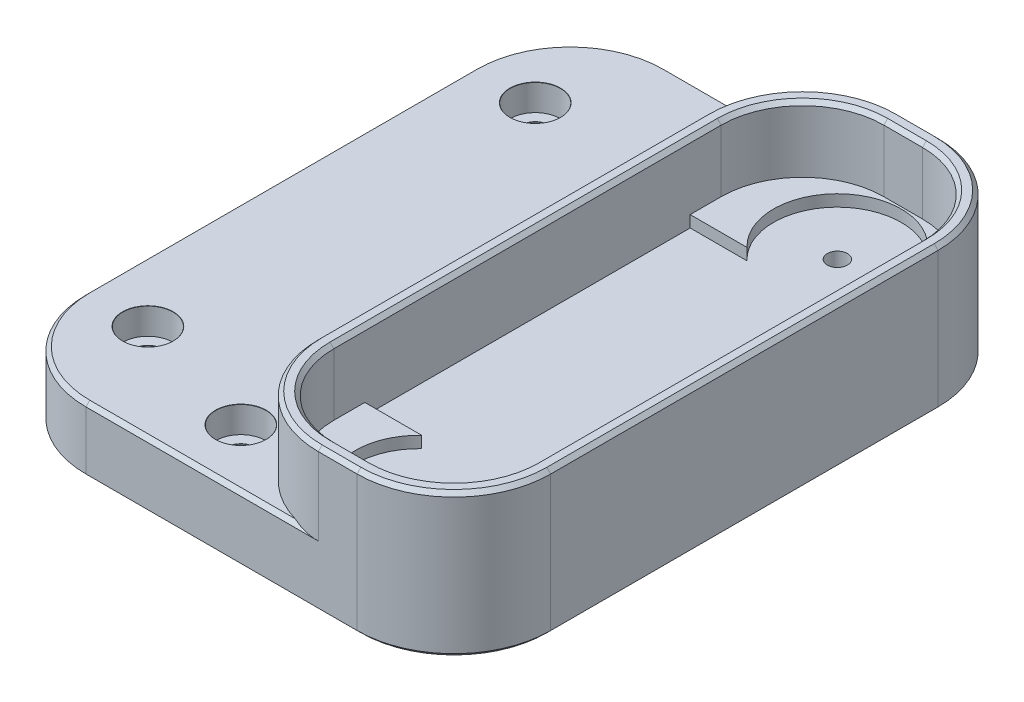
from build123d import *

# Parameters (mm, degrees)
BOSS_EXTRUDE1_DEPTH                          = 75
SKETCH2_R                                    = 1.3
CUT_EXTRUDE1_DEPTH                           = 34
CBORE_FOR_M3_HEX_SOCKET_HEAD_CAP_SCR_2_COUNT = 2
CBORE_FOR_M3_HEX_SOCKET_HEAD_CAP_SCR_2_PITCH = 60
CBORE_FOR_M3_HEX_SOCKET_HEAD_CAP_SCR_3_COUNT = 2
CBORE_FOR_M3_HEX_SOCKET_HEAD_CAP_SCR_3_PITCH = 57.567351858
CBORE_FOR_M3_HEX_SOCKET_HEAD_CAP_SCR_4_COUNT = 2
CBORE_FOR_M3_HEX_SOCKET_HEAD_CAP_SCR_4_PITCH = 17.720045147
FILLET2_R                                    = 12.5
BOSS_EXTRUDE2_START                          = 10
BOSS_EXTRUDE2_DEPTH                          = 10
CHAMFER3_SIZE                                = 0.5
BOSS_EXTRUDE3_START                          = 1.5
BOSS_EXTRUDE3_DEPTH                          = 1.5


with BuildPart() as part:
    # Sketch1 → Boss-Extrude1 (new body)
    with BuildSketch(Plane.XY):
        Polygon((0, 0), (60, 0), (60, 8.5), (30, 8.5), (0, 8.5), align=None)
    extrude(amount=BOSS_EXTRUDE1_DEPTH)

    # Sketch2 → Cut-Extrude1 (cut)
    with BuildSketch(Plane(origin=(0, 8.5, 0), x_dir=(1, 0, 0), z_dir=(0, 1, 0))):
        with Locations(Location((45, -64.5, 0), (0, 0, 180))):
            Circle(SKETCH2_R)
        with Locations(Location((45, -10.5, 0), (0, 0, 180))):
            Circle(SKETCH2_R)
    extrude(amount=-CUT_EXTRUDE1_DEPTH, mode=Mode.SUBTRACT)

    # Sketch4 → CBORE for M3 Hex Socket Head Cap Screw1 (revolve, cut)
    with BuildSketch(Plane(origin=(25, 8.5, 67.5), x_dir=(0, 0, 1), z_dir=(1, 0, 0))):
        Polygon((0, 0), (0, 8.5), (1.825, 8.5), (1.8, 8.475), (1.8, 3.425), (1.825, 3.4), (3.25, 3.4), (3.25, 0.025), (3.275, 0), align=None)
    cbore_for_m3_hex_socket_head_cap_screw1 = revolve(axis=Axis((25, 14.85, 67.5), (0, -1, 0)), mode=Mode.SUBTRACT)

    # CBORE for M3 Hex Socket Head Cap Scr 2: CBORE for M3 Hex Socket Head Cap Screw1 ×2
    with Locations(*[(0, 0, -i * CBORE_FOR_M3_HEX_SOCKET_HEAD_CAP_SCR_2_PITCH) for i in range(1, CBORE_FOR_M3_HEX_SOCKET_HEAD_CAP_SCR_2_COUNT)]):
        add(cbore_for_m3_hex_socket_head_cap_screw1, mode=Mode.SUBTRACT)

    # CBORE for M3 Hex Socket Head Cap Scr 3: CBORE for M3 Hex Socket Head Cap Screw1 ×2
    with Locations(*[Vector(-0.2953062708492605, 0, -0.9554026409829016) * (i * CBORE_FOR_M3_HEX_SOCKET_HEAD_CAP_SCR_3_PITCH) for i in range(1, CBORE_FOR_M3_HEX_SOCKET_HEAD_CAP_SCR_3_COUNT)]):
        add(cbore_for_m3_hex_socket_head_cap_screw1, mode=Mode.SUBTRACT)

    # CBORE for M3 Hex Socket Head Cap Scr 4: CBORE for M3 Hex Socket Head Cap Screw1 ×2
    with Locations(*[Vector(-0.9593655015712707, 0, -0.28216632399155017) * (i * CBORE_FOR_M3_HEX_SOCKET_HEAD_CAP_SCR_4_PITCH) for i in range(1, CBORE_FOR_M3_HEX_SOCKET_HEAD_CAP_SCR_4_COUNT)]):
        add(cbore_for_m3_hex_socket_head_cap_screw1, mode=Mode.SUBTRACT)

    # Fillet2
    fillet2_edges = [part.edges().sort_by_distance(p)[0] for p in [
        (60, 4.25, 75),
        (0, 4.25, 75),
        (60, 4.25, 0),
        (0, 4.25, 0),
    ]]
    fillet(fillet2_edges, radius=FILLET2_R)

    # Sketch5 → Boss-Extrude2 (add)
    with BuildSketch(Plane(origin=(0, 8.5, 0), x_dir=(1, 0, 0), z_dir=(0, 1, 0)).offset(BOSS_EXTRUDE2_START)):
        with BuildLine():
            Line((47.5, 0), (42.5, 0))
            ThreePointArc((42.5, 0), (33.661165235, -3.661165235), (30, -12.5))
            Line((30, -12.5), (30, -62.5))
            ThreePointArc((30, -62.5), (33.661165235, -71.338834765), (42.5, -75))
            Line((42.5, -75), (47.5, -75))
            ThreePointArc((47.5, -75), (56.338834765, -71.338834765), (60, -62.5))
            Line((60, -62.5), (60, -12.5))
            ThreePointArc((60, -12.5), (56.338834765, -3.661165235), (47.5, 0))
        make_face()
        with BuildLine():
            Line((47.5, -2), (42.5, -2))
            ThreePointArc((42.5, -2), (35.075378798, -5.075378798), (32, -12.5))
            Line((32, -12.5), (32, -62.5))
            ThreePointArc((32, -62.5), (35.075378798, -69.924621202), (42.5, -73))
            Line((42.5, -73), (47.5, -73))
            ThreePointArc((47.5, -73), (54.924621202, -69.924621202), (58, -62.5))
            Line((58, -62.5), (58, -12.5))
            ThreePointArc((58, -12.5), (54.924621202, -5.075378798), (47.5, -2))
        make_face(mode=Mode.SUBTRACT)
    extrude(amount=-BOSS_EXTRUDE2_DEPTH)

    # Chamfer3
    chamfer3_edges = [part.edges().sort_by_distance(p)[0] for p in [
        (27.5, 8.5, 0),
        (27.5, 8.5, 75),
        (33.661165235, 18.5, 3.661165235),
        (30, 18.5, 37.5),
        (33.661165235, 18.5, 71.338834765),
        (45, 18.5, 75),
        (56.338834765, 18.5, 71.338834765),
        (60, 18.5, 37.5),
        (56.338834765, 18.5, 3.661165235),
        (45, 18.5, 0),
        (35.075378798, 18.5, 69.924621202),
        (45, 18.5, 73),
        (54.924621202, 18.5, 69.924621202),
        (58, 18.5, 37.5),
        (54.924621202, 18.5, 5.075378798),
        (45, 18.5, 2),
        (35.075378798, 18.5, 5.075378798),
        (32, 18.5, 37.5),
        (0, 0, 37.5),
        (0, 8.5, 37.5),
        (30, 0, 0),
        (60, 0, 37.5),
        (30, 0, 75),
        (56.338834765, 0, 71.338834765),
        (56.338834765, 0, 3.661165235),
        (3.661165235, 0, 71.338834765),
        (3.661165235, 0, 3.661165235),
        (3.661165235, 8.5, 71.338834765),
        (3.661165235, 8.5, 3.661165235),
    ]]
    chamfer(chamfer3_edges, length=CHAMFER3_SIZE)

    # Sketch6 → Boss-Extrude3 (add)
    with BuildSketch(Plane(origin=(0, 8.5, 0), x_dir=(1, 0, 0), z_dir=(0, 1, 0)).offset(BOSS_EXTRUDE3_START)):
        with BuildLine():
            Line((50.662375826, -16.5), (58, -16.5))
            Line((58, -16.5), (58, -12.5))
            ThreePointArc((58, -12.5), (54.924621202, -5.075378798), (47.5, -2))
            Line((47.5, -2), (42.5, -2))
            ThreePointArc((42.5, -2), (35.075378798, -5.075378798), (32, -12.5))
            Line((32, -12.5), (32, -16.5))
            Line((32, -16.5), (39.337624174, -16.5))
            ThreePointArc((39.337624174, -16.5), (41.732898882, -2.924476897), (53.25, -10.5))
            ThreePointArc((53.25, -10.5), (52.575523103, -13.767101118), (50.662375826, -16.5))
        make_face()
        with BuildLine():
            Line((58, -62.5), (58, -58.5))
            Line((58, -58.5), (50.662375826, -58.5))
            ThreePointArc((50.662375826, -58.5), (52.575523103, -61.232898882), (53.25, -64.5))
            ThreePointArc((53.25, -64.5), (41.732898882, -72.075523103), (39.337624174, -58.5))
            Line((39.337624174, -58.5), (32, -58.5))
            Line((32, -58.5), (32, -62.5))
            ThreePointArc((32, -62.5), (35.075378798, -69.924621202), (42.5, -73))
            Line((42.5, -73), (47.5, -73))
            ThreePointArc((47.5, -73), (54.924621202, -69.924621202), (58, -62.5))
        make_face()
    extrude(amount=-BOSS_EXTRUDE3_DEPTH)


solid = part.part
